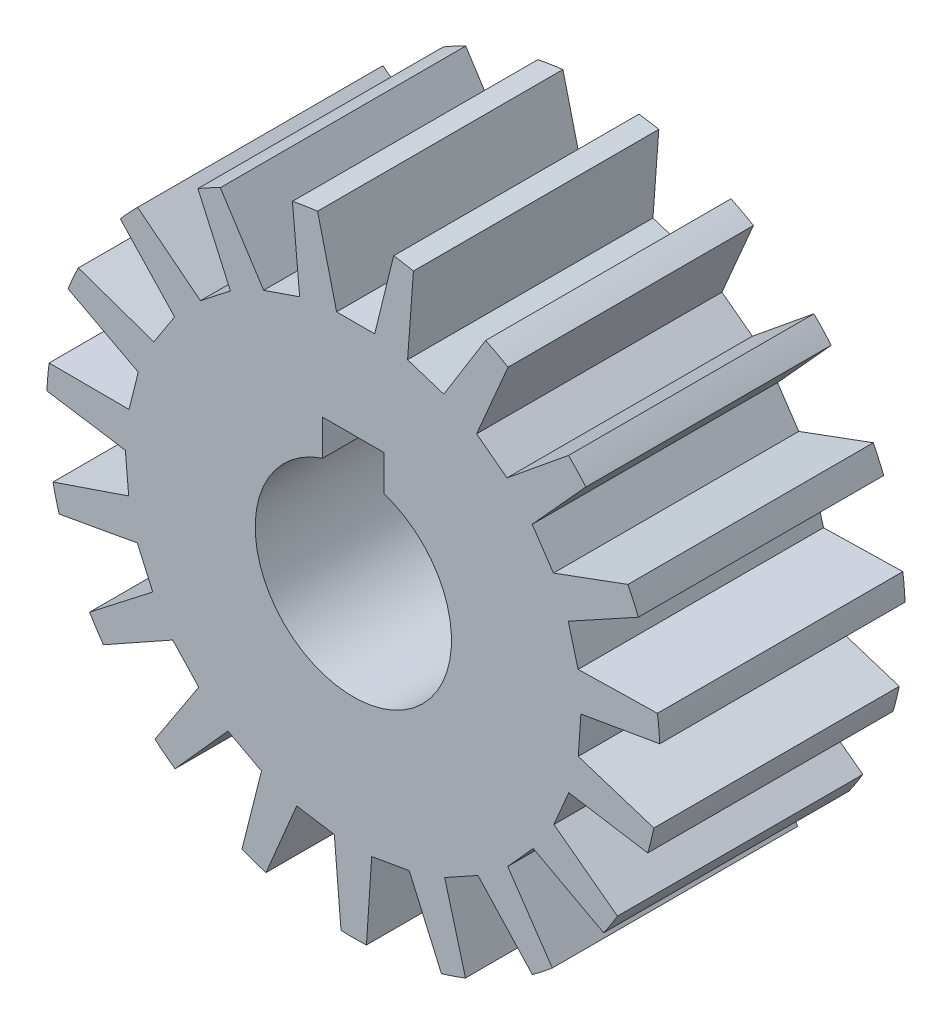
from build123d import *

# Parameters (mm, degrees)
CROQUIS1_R              = 12.5
SALIENTE_EXTRUIR1_DEPTH = 10
CORTAR_EXTRUIR1_DEPTH   = 21.310096012
MATRIZC1_COUNT          = 19
MATRIZC1_ANGLE          = 342
CORTAR_EXTRUIR2_DEPTH   = 10


with BuildPart() as part:
    # Croquis1 → Saliente-Extruir1 (new body)
    with BuildSketch(Plane.XY):
        Circle(CROQUIS1_R)
    extrude(amount=SALIENTE_EXTRUIR1_DEPTH)

    # Croquis2 → Cortar-Extruir1 (cut, through all)
    with BuildSketch(Plane(origin=(0, 0, 0), x_dir=(-1, 0, 0), z_dir=(0, 0, -1))):
        Polygon((-1.66896446, 12.5), (-0.871074147, 9.25), (0.68103554, 9.25), (1.478925853, 12.5), align=None)
    cortar_extruir1 = extrude(amount=-CORTAR_EXTRUIR1_DEPTH, mode=Mode.SUBTRACT)

    # MatrizC1: Cortar-Extruir1 ×19 about axis
    matrizc1_axis = Axis((0, 0, 0), (0, 0, 1))
    for i in range(1, MATRIZC1_COUNT):
        add(cortar_extruir1.rotate(matrizc1_axis, i * MATRIZC1_ANGLE / (MATRIZC1_COUNT - 1)), mode=Mode.SUBTRACT)

    # Croquis3 → Cortar-Extruir2 (cut)
    with BuildSketch(Plane(origin=(0, 0, 0), x_dir=(-1, 0, 0), z_dir=(0, 0, -1))):
        with BuildLine():
            Line((-1.25, 3.799671038), (-1.25, 5.25))
            Line((-1.25, 5.25), (1.25, 5.25))
            Line((1.25, 5.25), (1.25, 3.799671038))
            ThreePointArc((1.25, 3.799671038), (0, -4), (-1.25, 3.799671038))
        make_face()
    extrude(amount=-CORTAR_EXTRUIR2_DEPTH, mode=Mode.SUBTRACT)


solid = part.part
